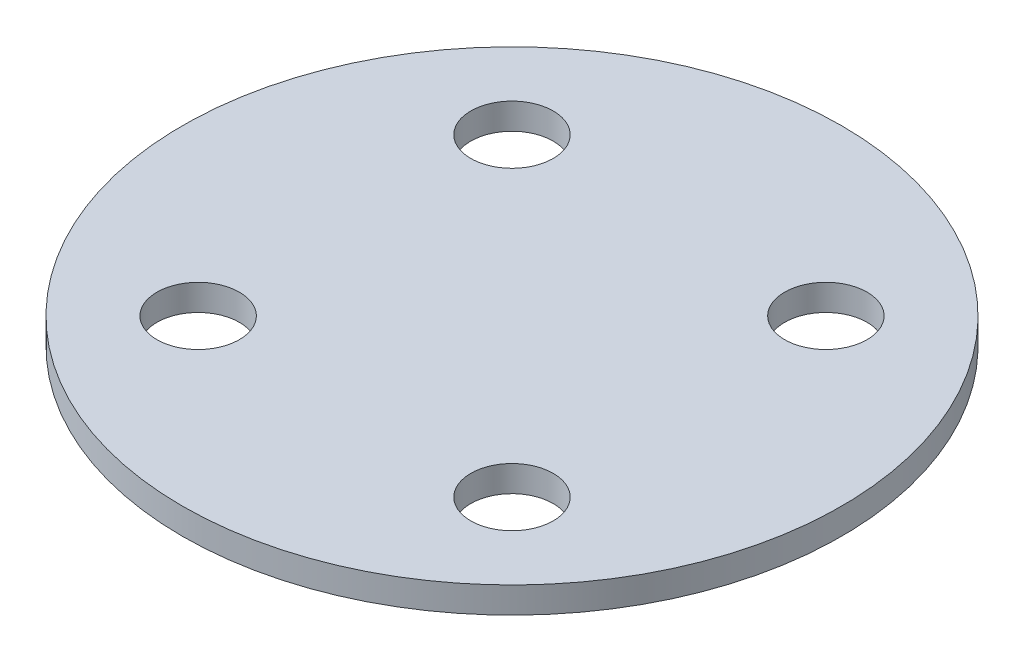
from build123d import *

# Parameters (mm, degrees)
SKETCH1_R           = 12.6
SKETCH1_R_2         = 1.575
BOSS_EXTRUDE1_DEPTH = 1


with BuildPart() as part:
    # Sketch1 → Boss-Extrude1 (new body)
    with BuildSketch(Plane.XZ.offset(-85.080072415)):
        with Locations(Location((-89.072792821, -47.25870832, 0), (0, 0, 270))):
            Circle(SKETCH1_R)
        with Locations(Location((-95.072792821, -41.25870832, 0), (0, 0, 270))):
            Circle(SKETCH1_R_2, mode=Mode.SUBTRACT)
        with Locations(Location((-83.072792821, -41.25870832, 0), (0, 0, 270))):
            Circle(SKETCH1_R_2, mode=Mode.SUBTRACT)
        with Locations(Location((-83.072792821, -53.25870832, 0), (0, 0, 270))):
            Circle(SKETCH1_R_2, mode=Mode.SUBTRACT)
        with Locations(Location((-95.072792821, -53.25870832, 0), (0, 0, 270))):
            Circle(SKETCH1_R_2, mode=Mode.SUBTRACT)
    extrude(amount=BOSS_EXTRUDE1_DEPTH)


solid = part.part
